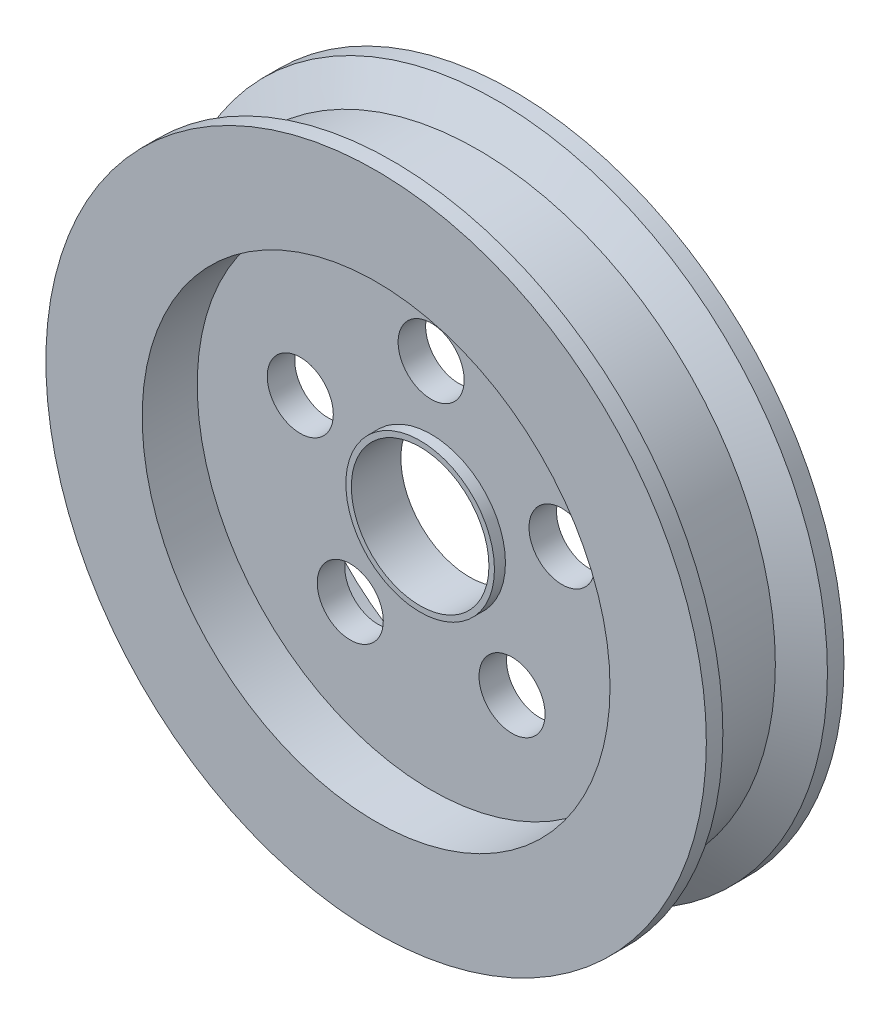
from build123d import *

# Parameters (mm, degrees)
SKETCH1_R                = 60
SKETCH1_R_2              = 12.5
BOSS_EXTRUDE1_DEPTH      = 12.5
SKETCH2_R                = 42.5
CUT_EXTRUDE1_DEPTH       = 10
SKETCH3_R                = 6
CUT_EXTRUDE2_DEPTH       = 87.168439698
CIRPATTERN1_COUNT        = 5
BOSS_EXTRUDE2_DEPTH      = 2
BOSS_EXTRUDE2_DEPTH_BACK = 7
SKETCH5_R                = 13.5
SKETCH5_R_2              = 12.5


with BuildPart() as part:
    # Sketch1 → Boss-Extrude1 (new, symmetric)
    with BuildSketch(Plane.XY):
        Circle(SKETCH1_R)
        Circle(SKETCH1_R_2, mode=Mode.SUBTRACT)
    extrude(amount=BOSS_EXTRUDE1_DEPTH, both=True)

    # Sketch2 → Cut-Extrude1 (cut)
    with BuildSketch(Plane.XY.offset(12.5)):
        Circle(SKETCH2_R)
    cut_extrude1 = extrude(amount=-CUT_EXTRUDE1_DEPTH, mode=Mode.SUBTRACT)

    # Mirror1: Cut-Extrude1 across plane
    add(cut_extrude1.mirror(Plane.XY), mode=Mode.SUBTRACT)

    # Sketch3 → Cut-Extrude2 (cut, through all)
    with BuildSketch(Plane.XY.offset(2.5)):
        with Locations((0, 25)):
            Circle(SKETCH3_R)
    cut_extrude2 = extrude(amount=-CUT_EXTRUDE2_DEPTH, mode=Mode.SUBTRACT)

    # CirPattern1: Cut-Extrude2 ×5 about axis
    cirpattern1_axis = Axis((0, 0, 0), (0, 0, 1))
    for i in range(1, CIRPATTERN1_COUNT):
        add(cut_extrude2.rotate(cirpattern1_axis, i * 360 / CIRPATTERN1_COUNT), mode=Mode.SUBTRACT)

    # Sketch4 → Cut-Revolve1 (revolve, cut)
    with BuildSketch(Plane(origin=(0, 0, 0), x_dir=(1, 0, 0), z_dir=(0, 1, 0))):
        Polygon((60, 9.5), (54, 6.035898385), (54, -6.035898385), (60, -9.5), align=None)
    revolve(axis=Axis((0, 0, 0), (0, 0, -1)), mode=Mode.SUBTRACT)

    # Sketch5 → Boss-Extrude2 (add, two sides: drawn at the far end of the back side and taken through both)
    with BuildSketch(Plane.XY.offset(2.5).offset(-BOSS_EXTRUDE2_DEPTH_BACK)):
        Circle(SKETCH5_R)
        Circle(SKETCH5_R_2, mode=Mode.SUBTRACT)
    extrude(amount=BOSS_EXTRUDE2_DEPTH + BOSS_EXTRUDE2_DEPTH_BACK)


solid = part.part
